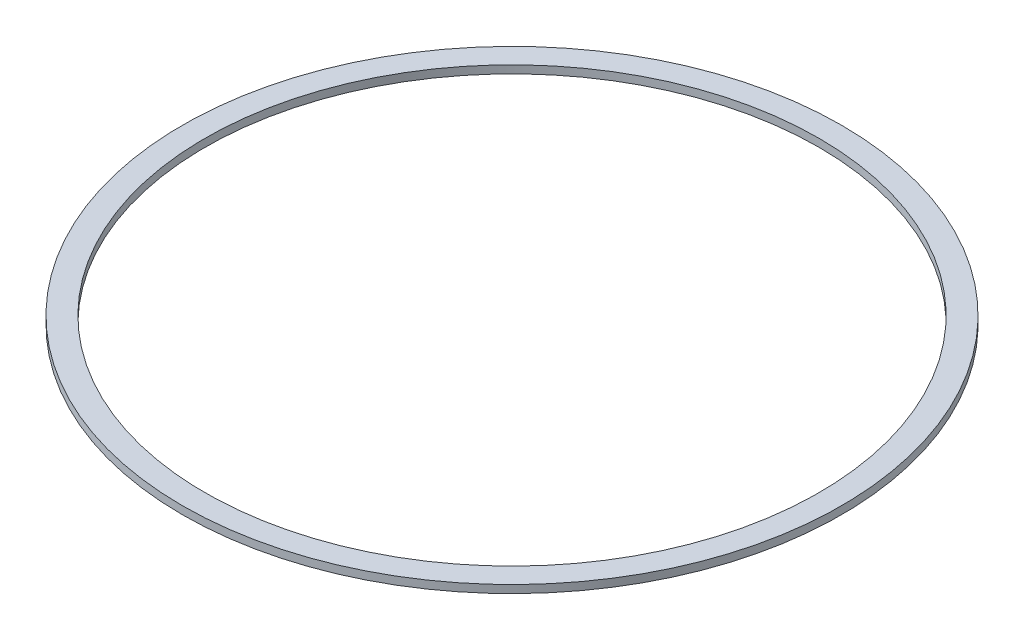
from build123d import *

# Parameters (mm, degrees)
SKETCH1_W = 7.5
SKETCH1_H = 2.61


with BuildPart() as part:
    # Sketch1 → Revolve1 (revolve)
    with BuildSketch(Plane.XY, mode=Mode.PRIVATE) as revolve1_sk:
        with Locations((-105.75, 4.48)):
            Rectangle(SKETCH1_W, SKETCH1_H)
    revolve(revolve1_sk.sketch.rotate(Axis((0, -200069.047495165, 0), (0, 1, 0)), 270), axis=Axis((0, -200069.047495165, 0), (0, 1, 0)))


solid = part.part
